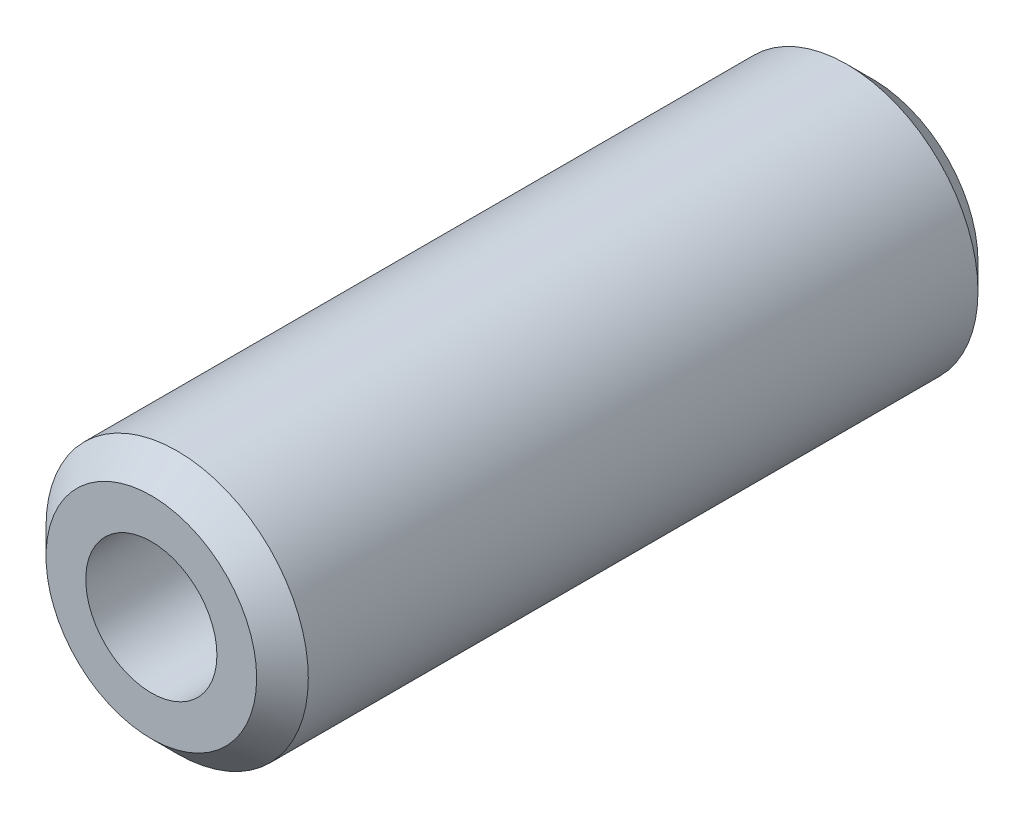
from build123d import *

# Parameters (mm, degrees)
SKETCH1_R           = 12.7
SKETCH1_R_2         = 6.35
BOSS_EXTRUDE1_DEPTH = 34.925
CHAMFER1_SIZE       = 2.5


with BuildPart() as part:
    # Sketch1 → Boss-Extrude1 (new, symmetric)
    with BuildSketch(Plane.XY):
        Circle(SKETCH1_R)
        Circle(SKETCH1_R_2, mode=Mode.SUBTRACT)
    extrude(amount=BOSS_EXTRUDE1_DEPTH, both=True)

    # Chamfer1
    chamfer1_edges = [part.edges().sort_by_distance(p)[0] for p in [
        (-12.7, 0, -34.925),
        (-12.7, 0, 34.925),
    ]]
    chamfer(chamfer1_edges, length=CHAMFER1_SIZE)


solid = part.part
